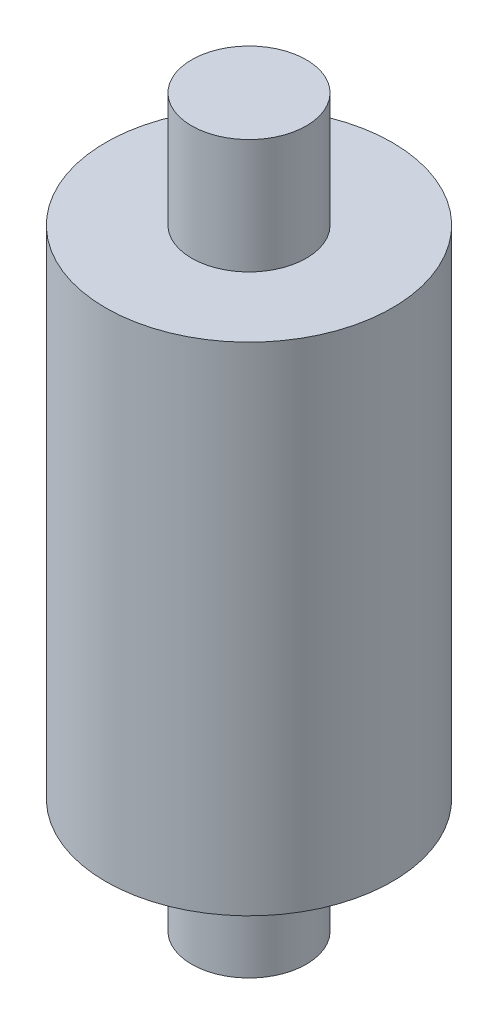
from build123d import *

# Parameters (mm, degrees)
SKETCH1_R           = 3
BOSS_EXTRUDE1_DEPTH = 19
SKETCH1_3_R         = 7.5
SKETCH1_3_R_2       = 3
BOSS_EXTRUDE2_DEPTH = 13


with BuildPart() as part:
    # Sketch1 → Boss-Extrude1 (new, symmetric)
    with BuildSketch(Plane(origin=(0, 0, 0), x_dir=(1, 0, 0), z_dir=(0, 1, 0))):
        Circle(SKETCH1_R)
    extrude(amount=BOSS_EXTRUDE1_DEPTH, both=True)

    # Sketch1<3> → Boss-Extrude2 (add, symmetric)
    with BuildSketch(Plane(origin=(0, 0, 0), x_dir=(1, 0, 0), z_dir=(0, 1, 0))):
        Circle(SKETCH1_3_R)
        Circle(SKETCH1_3_R_2, mode=Mode.SUBTRACT)
    extrude(amount=BOSS_EXTRUDE2_DEPTH, both=True)


solid = part.part
